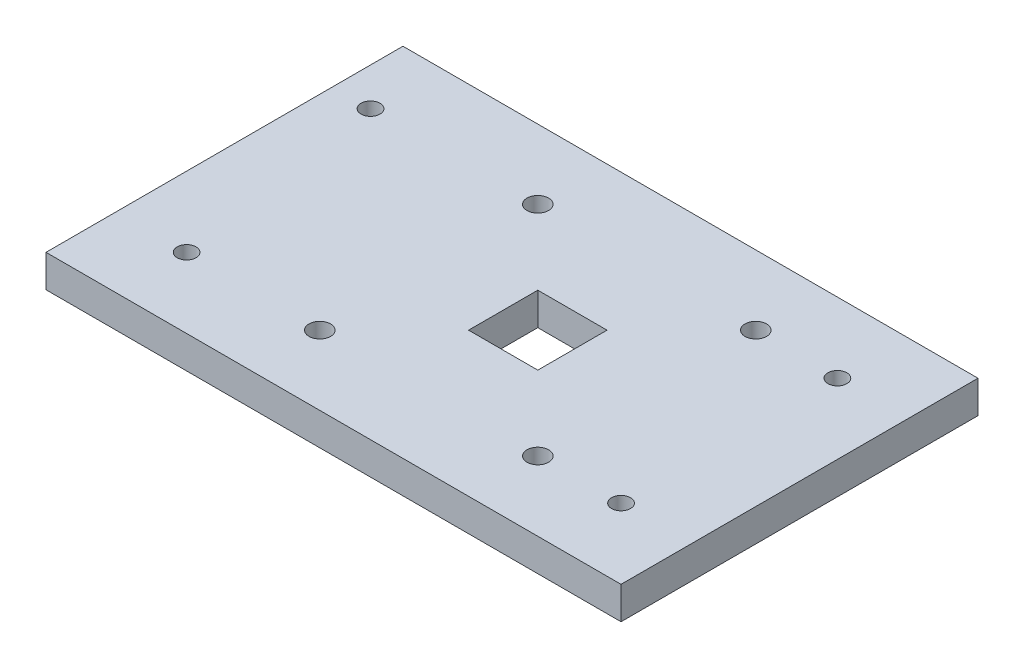
from build123d import *

# Parameters (mm, degrees)
SKETCH1_W           = 106.32
SKETCH1_H           = 66
SKETCH1_R           = 2
SKETCH1_W_2         = 12.8
SKETCH1_H_2         = 12.8
BOSS_EXTRUDE1_DEPTH = 6
SKETCH4_R           = 1.75
CUT_EXTRUDE1_DEPTH  = 67.939412158


with BuildPart() as part:
    # Sketch1 → Boss-Extrude1 (new body)
    with BuildSketch(Plane(origin=(0, 0, 0), x_dir=(1, 0, 0), z_dir=(0, 1, 0))):
        with Locations((-4.77, 0)):
            Rectangle(SKETCH1_W, SKETCH1_H)
        with Locations(Location((20.152543264, -20.152543264, 0), (0, 0, 270))):
            Circle(SKETCH1_R, mode=Mode.SUBTRACT)
        with Locations(Location((20.152543264, 20.152543264, 0), (0, 0, 270))):
            Circle(SKETCH1_R, mode=Mode.SUBTRACT)
        with Locations(Location((-20.152543264, -20.152543264, 0), (0, 0, 270))):
            Circle(SKETCH1_R, mode=Mode.SUBTRACT)
        with Locations(Location((-20.152543264, 20.152543264, 0), (0, 0, 270))):
            Circle(SKETCH1_R, mode=Mode.SUBTRACT)
        Rectangle(SKETCH1_W_2, SKETCH1_H_2, mode=Mode.SUBTRACT)
    extrude(amount=BOSS_EXTRUDE1_DEPTH)

    # Sketch4 → Cut-Extrude1 (cut, through all)
    with BuildSketch(Plane(origin=(0, 6, 0), x_dir=(1, 0, 0), z_dir=(0, 1, 0))):
        with Locations(Location((-50.93, 20, 0), (0, 0, 270))):
            Circle(SKETCH4_R)
        with Locations(Location((-44.93, -20, 0), (0, 0, 270))):
            Circle(SKETCH4_R)
        with Locations(Location((35.39, -20, 0), (0, 0, 270))):
            Circle(SKETCH4_R)
        with Locations(Location((35.39, 20, 0), (0, 0, 270))):
            Circle(SKETCH4_R)
    extrude(amount=-CUT_EXTRUDE1_DEPTH, mode=Mode.SUBTRACT)


solid = part.part
